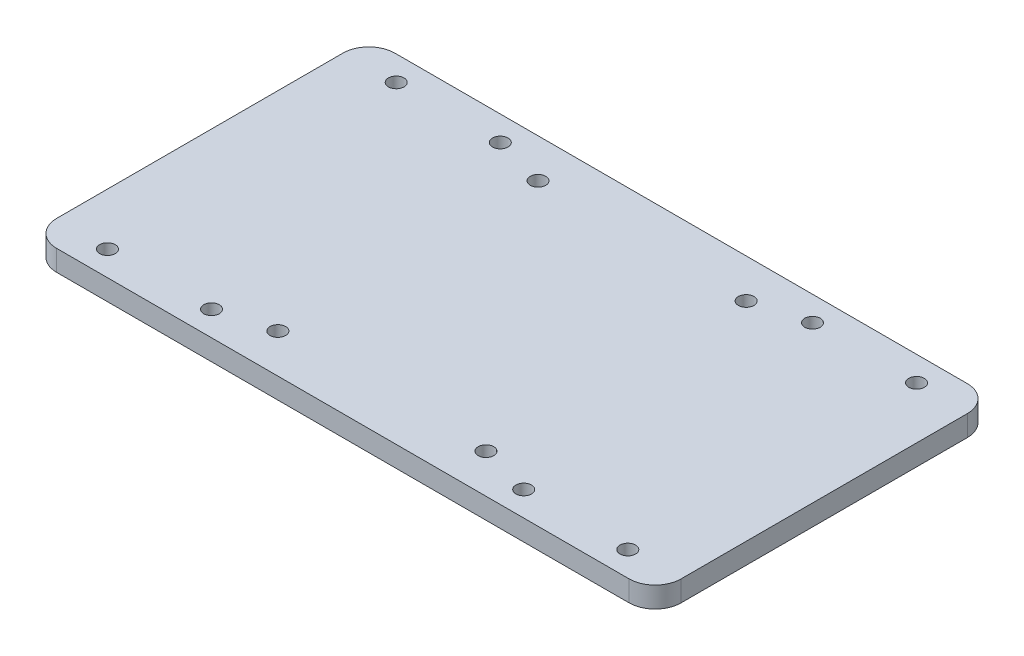
from build123d import *

# Parameters (mm, degrees)
SKETCH_1_W          = 120
SKETCH_1_H          = 65
EXTRUDE_1_DEPTH     = 4
SKETCH_2_R          = 1.5
CUT_EXTRUDE_1_DEPTH = 4
FILLET_1_R          = 5
SKETCH_3_R          = 1.5
CUT_EXTRUDE_2_DEPTH = 4


with BuildPart() as part:
    # 草图1 → 凸台-拉伸1 (new body)
    with BuildSketch(Plane(origin=(0, 0, 0), x_dir=(1, 0, 0), z_dir=(0, 1, 0))):
        Rectangle(SKETCH_1_W, SKETCH_1_H)
    extrude(amount=EXTRUDE_1_DEPTH)

    # 草图2 → 切除-拉伸1 (cut)
    with BuildSketch(Plane(origin=(0, 4, 0), x_dir=(1, 0, 0), z_dir=(0, 1, 0))):
        with Locations(Location((50, -27.75, 0), (0, 0, 270))):
            Circle(SKETCH_2_R)
        with Locations(Location((50, 27.75, 0), (0, 0, 270))):
            Circle(SKETCH_2_R)
        with Locations(Location((30, 27.75, 0), (0, 0, 270))):
            Circle(SKETCH_2_R)
        with Locations(Location((30, -27.75, 0), (0, 0, 270))):
            Circle(SKETCH_2_R)
    cut_extrude_1 = extrude(amount=-CUT_EXTRUDE_1_DEPTH, mode=Mode.SUBTRACT)

    # 镜向2: 切除-拉伸1 across plane
    add(cut_extrude_1.mirror(Plane(origin=(0, 0, 0), x_dir=(0, 0, 1), z_dir=(1, 0, 0))), mode=Mode.SUBTRACT)

    # 圆角1
    fillet_1_edges = [part.edges().sort_by_distance(p)[0] for p in [
        (60, 2, 32.5),
        (-60, 2, 32.5),
        (-60, 2, -32.5),
        (60, 2, -32.5),
    ]]
    fillet(fillet_1_edges, radius=FILLET_1_R)

    # 草图3 → 切除-拉伸2 (cut)
    with BuildSketch(Plane(origin=(0, 4, 0), x_dir=(1, 0, 0), z_dir=(0, 1, 0))):
        with Locations(Location((-20, 25, 0), (0, 0, 270))):
            Circle(SKETCH_3_R)
        with Locations(Location((20, 25, 0), (0, 0, 270))):
            Circle(SKETCH_3_R)
        with Locations(Location((20, -25, 0), (0, 0, 270))):
            Circle(SKETCH_3_R)
        with Locations(Location((-20, -25, 0), (0, 0, 270))):
            Circle(SKETCH_3_R)
    extrude(amount=-CUT_EXTRUDE_2_DEPTH, mode=Mode.SUBTRACT)


solid = part.part
